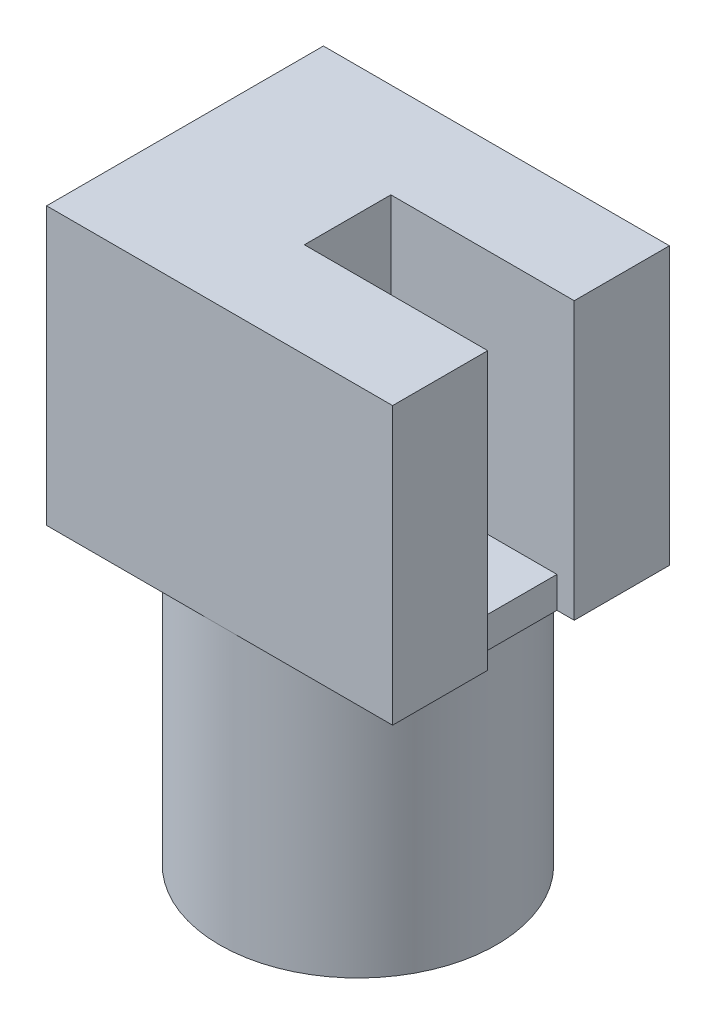
from build123d import *

# Parameters (mm, degrees)
SKETCH1_R           = 20
BOSS_EXTRUDE1_DEPTH = 40
SKETCH2_R           = 2.7
CUT_EXTRUDE1_DEPTH  = 3.5
SKETCH3_W           = 40
SKETCH3_H           = 40
BOSS_EXTRUDE2_DEPTH = 25
SKETCH4_W           = 12.5
SKETCH4_H           = 40
CUT_EXTRUDE2_DEPTH  = 2.5
SKETCH5_W           = 12.5
SKETCH5_H           = 35.5
CUT_EXTRUDE3_DEPTH  = 24


with BuildPart() as part:
    # Sketch1 → Boss-Extrude1 (new body)
    with BuildSketch(Plane(origin=(0, 0, 0), x_dir=(1, 0, 0), z_dir=(0, 1, 0))):
        with Locations(Location((0, 0, 0), (0, 0, 270))):
            Circle(SKETCH1_R)
    extrude(amount=BOSS_EXTRUDE1_DEPTH)

    # Sketch2 → Cut-Extrude1 (cut)
    with BuildSketch(Plane.XZ):
        with Locations(Location((0, 0, 0), (0, 0, 270))):
            Circle(SKETCH2_R)
    extrude(amount=-CUT_EXTRUDE1_DEPTH, mode=Mode.SUBTRACT)

    # Sketch3 → Boss-Extrude2 (add, symmetric)
    with BuildSketch(Plane(origin=(0, 0, 0), x_dir=(0, 0, -1), z_dir=(1, 0, 0))):
        with Locations((0, 60)):
            Rectangle(SKETCH3_W, SKETCH3_H)
    extrude(amount=BOSS_EXTRUDE2_DEPTH, both=True)

    # Sketch4 → Cut-Extrude2 (cut)
    with BuildSketch(Plane(origin=(25, 0, 0), x_dir=(0, 0, -1), z_dir=(1, 0, 0))):
        with Locations((0, 60)):
            Rectangle(SKETCH4_W, SKETCH4_H)
    extrude(amount=-CUT_EXTRUDE2_DEPTH, mode=Mode.SUBTRACT)

    # Sketch5 → Cut-Extrude3 (cut)
    with BuildSketch(Plane(origin=(22.5, 0, 0), x_dir=(0, 0, -1), z_dir=(1, 0, 0))):
        with Locations((0, 62.25)):
            Rectangle(SKETCH5_W, SKETCH5_H)
    extrude(amount=-CUT_EXTRUDE3_DEPTH, mode=Mode.SUBTRACT)


solid = part.part
